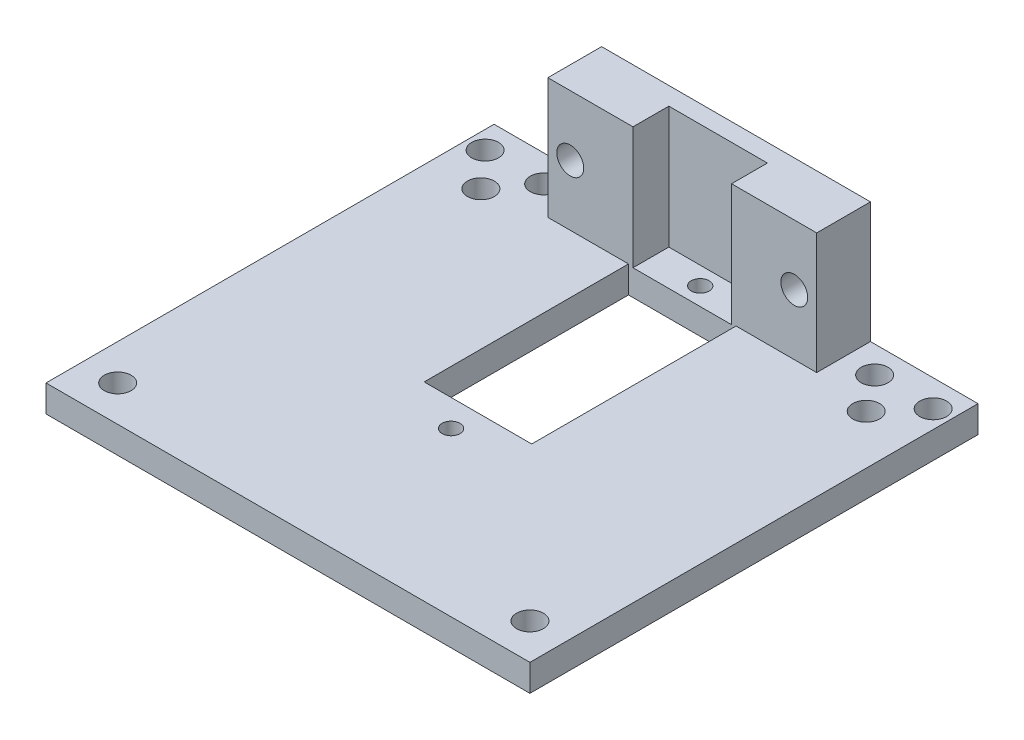
from build123d import *

# Parameters (mm, degrees)
SKETCH1_R           = 1.5
BOSS_EXTRUDE1_DEPTH = 6
SKETCH2_W           = 54
SKETCH2_H           = 3
BOSS_EXTRUDE2_DEPTH = 50
SKETCH4_R           = 1.5
SKETCH4_R_2         = 1
SKETCH4_W           = 12
SKETCH4_H           = 22.8
CUT_EXTRUDE1_DEPTH  = 24
SKETCH5_W           = 11
SKETCH5_H           = 4
CUT_EXTRUDE2_DEPTH  = 13.62
SKETCH6_R           = 1
CUT_EXTRUDE3_DEPTH  = 24
SKETCH7_R           = 1.5
CUT_EXTRUDE4_DEPTH  = 7
SKETCH8_R           = 1.5
CUT_EXTRUDE5_DEPTH  = 7
SKETCH3_R           = 1.5
CUT_EXTRUDE6_DEPTH  = 60
SKETCH9_R           = 1.5
CUT_EXTRUDE7_DEPTH  = 10


with BuildPart() as part:
    # Sketch1 → Boss-Extrude1 (new body)
    with BuildSketch(Plane.XY):
        Polygon((0, 0), (-4, 0), (-4, 20), (8, 20), (8, 33.5), (38, 33.5), (38, 20), (50, 20), (50, 0), (46, 0), (46, 17), (0, 17), align=None)
        with Locations((10.5, 26.75)):
            Circle(SKETCH1_R, mode=Mode.SUBTRACT)
        with Locations(Location((35.5, 26.75, 0), (0, 0, 180))):
            Circle(SKETCH1_R, mode=Mode.SUBTRACT)
    extrude(amount=BOSS_EXTRUDE1_DEPTH)

    # Sketch2 → Boss-Extrude2 (add)
    with BuildSketch(Plane.XY):
        with Locations((23, 18.5)):
            Rectangle(SKETCH2_W, SKETCH2_H)
    extrude(amount=BOSS_EXTRUDE2_DEPTH)

    # Sketch4 → Cut-Extrude1 (cut)
    with BuildSketch(Plane(origin=(0, 20, 0), x_dir=(1, 0, 0), z_dir=(0, 1, 0))):
        with Locations(Location((4.534048473, -3, 0), (0, 0, 270))):
            Circle(SKETCH4_R)
        with Locations(Location((1.5, -6.974235758, 0), (0, 0, 270))):
            Circle(SKETCH4_R)
        with Locations(Location((41.465951527, -3, 0), (0, 0, 180))):
            Circle(SKETCH4_R)
        with Locations(Location((44.5, -6.974235758, 0), (0, 0, 180))):
            Circle(SKETCH4_R)
        with Locations(Location((23, -31.8, 0), (0, 0, 270))):
            Circle(SKETCH4_R_2)
        with Locations((23, -17.4)):
            Rectangle(SKETCH4_W, SKETCH4_H)
    extrude(amount=-CUT_EXTRUDE1_DEPTH, mode=Mode.SUBTRACT)

    # Sketch5 → Cut-Extrude2 (cut)
    with BuildSketch(Plane(origin=(0, 33.5, 0), x_dir=(1, 0, 0), z_dir=(0, 1, 0))):
        with Locations((23, -4)):
            Rectangle(SKETCH5_W, SKETCH5_H)
    extrude(amount=-CUT_EXTRUDE2_DEPTH, mode=Mode.SUBTRACT)

    # Sketch6 → Cut-Extrude3 (cut)
    with BuildSketch(Plane(origin=(0, 19.88, 0), x_dir=(1, 0, 0), z_dir=(0, 1, 0))):
        with Locations(Location((23, -4, 0), (0, 0, 270))):
            Circle(SKETCH6_R)
    extrude(amount=-CUT_EXTRUDE3_DEPTH, mode=Mode.SUBTRACT)

    # Sketch7 → Cut-Extrude4 (cut)
    with BuildSketch(Plane.XZ):
        with Locations((48, 3)):
            Circle(SKETCH7_R)
    extrude(amount=-CUT_EXTRUDE4_DEPTH, mode=Mode.SUBTRACT)

    # Sketch8 → Cut-Extrude5 (cut)
    with BuildSketch(Plane.XZ):
        with Locations(Location((-2, 3, 0), (0, 0, 270))):
            Circle(SKETCH8_R)
    extrude(amount=-CUT_EXTRUDE5_DEPTH, mode=Mode.SUBTRACT)

    # Sketch3 → Cut-Extrude6 (cut)
    with BuildSketch(Plane(origin=(0, 20, 0), x_dir=(1, 0, 0), z_dir=(0, 1, 0))):
        with Locations(Location((0, -46, 0), (0, 0, 270))):
            Circle(SKETCH3_R)
        with Locations(Location((46, -46, 0), (0, 0, 270))):
            Circle(SKETCH3_R)
    extrude(amount=-CUT_EXTRUDE6_DEPTH, mode=Mode.SUBTRACT)

    # Sketch9 → Cut-Extrude7 (cut)
    with BuildSketch(Plane.XZ.offset(-17)):
        with Locations((48, 3)):
            Circle(SKETCH9_R)
        with Locations(Location((-2, 3, 0), (0, 0, 270))):
            Circle(SKETCH9_R)
    extrude(amount=-CUT_EXTRUDE7_DEPTH, mode=Mode.SUBTRACT)

    # SurfaceCut1
    split(bisect_by=Plane(origin=(0, 17, 0), x_dir=(-1, 0, 0), z_dir=(0, -1, 0)), keep=Keep.BOTTOM)


solid = part.part
